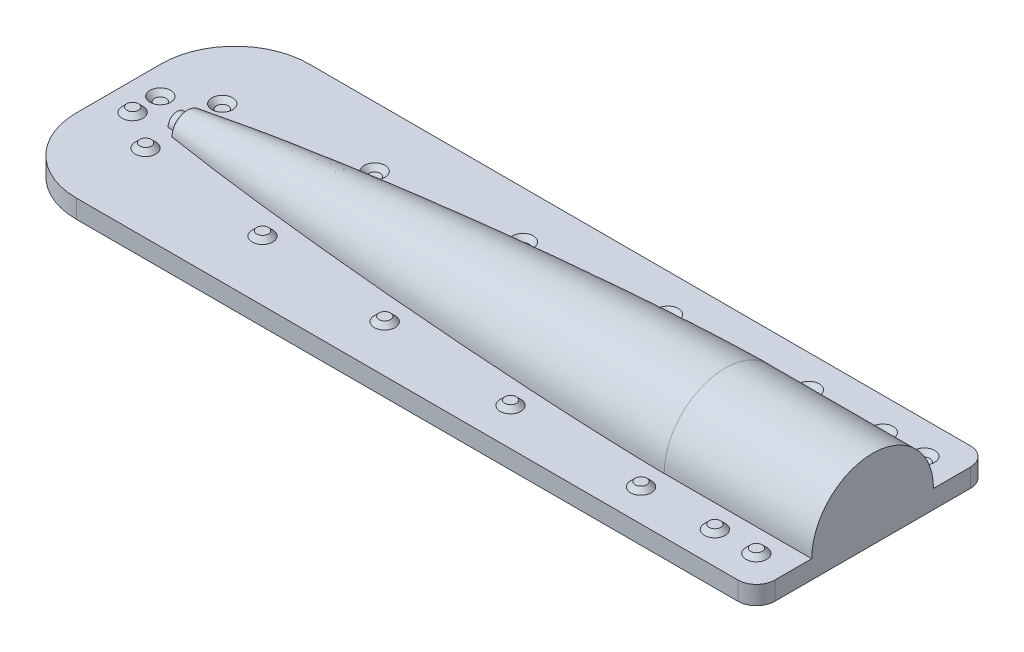
from build123d import *

# Parameters (mm, degrees)
MAIN_BODY_ANGLE               = 180
SKETCH2_W                     = 1128.421746079
SKETCH2_H                     = 320.04
BOSS_EXTRUDE1_DEPTH           = 25.4
FILLET1_R                     = 6.35
SKETCH3_R                     = 14.2875
BOSS_EXTRUDE2_DEPTH           = 6.35
BOSS_EXTRUDE2_DRAFT           = 45
BOSS_EXTRUDE2_PROFILE_2_DEPTH = 6.35
BOSS_EXTRUDE2_PROFILE_2_DRAFT = 45
BOSS_EXTRUDE2_PROFILE_3_DEPTH = 6.35
BOSS_EXTRUDE2_PROFILE_3_DRAFT = 45
BOSS_EXTRUDE2_PROFILE_4_DEPTH = 6.35
BOSS_EXTRUDE2_PROFILE_4_DRAFT = 45
BOSS_EXTRUDE2_PROFILE_5_DEPTH = 6.35
BOSS_EXTRUDE2_PROFILE_5_DRAFT = 45
BOSS_EXTRUDE2_PROFILE_6_DEPTH = 6.35
BOSS_EXTRUDE2_PROFILE_6_DRAFT = 45
BOSS_EXTRUDE2_PROFILE_7_DEPTH = 6.35
BOSS_EXTRUDE2_PROFILE_7_DRAFT = 45
BOSS_EXTRUDE2_PROFILE_8_DEPTH = 6.35
BOSS_EXTRUDE2_PROFILE_8_DRAFT = 45
BOSS_EXTRUDE2_PROFILE_9_DEPTH = 6.35
BOSS_EXTRUDE2_PROFILE_9_DRAFT = 45
SKETCH4_R                     = 14.2875
CUT_EXTRUDE1_DEPTH            = 6.35
CUT_EXTRUDE1_DRAFT            = -45
CUT_EXTRUDE1_PROFILE_2_DEPTH  = 6.35
CUT_EXTRUDE1_PROFILE_2_DRAFT  = -45
CUT_EXTRUDE1_PROFILE_3_DEPTH  = 6.35
CUT_EXTRUDE1_PROFILE_3_DRAFT  = -45
CUT_EXTRUDE1_PROFILE_4_DEPTH  = 6.35
CUT_EXTRUDE1_PROFILE_4_DRAFT  = -45
CUT_EXTRUDE1_PROFILE_5_DEPTH  = 6.35
CUT_EXTRUDE1_PROFILE_5_DRAFT  = -45
CUT_EXTRUDE1_PROFILE_6_DEPTH  = 6.35
CUT_EXTRUDE1_PROFILE_6_DRAFT  = -45
CUT_EXTRUDE1_PROFILE_7_DEPTH  = 6.35
CUT_EXTRUDE1_PROFILE_7_DRAFT  = -45
CUT_EXTRUDE1_PROFILE_8_DEPTH  = 6.35
CUT_EXTRUDE1_PROFILE_8_DRAFT  = -45
CUT_EXTRUDE1_PROFILE_9_DEPTH  = 6.35
CUT_EXTRUDE1_PROFILE_9_DRAFT  = -45
SKETCH5_W                     = 463.80049478
SKETCH5_H                     = 192.61122876
CUT_EXTRUDE2_DEPTH            = 90.587892
FILLET2_R                     = 25.4
FILLET3_R                     = 101.6


with BuildPart() as part:
    # Sketch1 → main body (revolve)
    with BuildSketch(Plane(origin=(0, 0, 0), x_dir=(1, 0, 0), z_dir=(0, 1, 0))):
        with BuildLine():
            Line((838.2, 83.82), (1041.4, 83.82))
            Line((1041.4, 83.82), (1055.402008508, 4.410663713))
            ThreePointArc((1055.402008508, 4.410663713), (1055.691236913, 2.213755866), (1055.787891581, 0))
            Line((1055.787891581, 0), (79.766145502, 0))
            ThreePointArc((79.766145502, 0), (80.010172441, 2.47764709), (80.732875439, 4.860079591))
            Line((80.732875439, 4.860079591), (83.9802768, 12.7))
            Line((83.9802768, 12.7), (96.6802768, 12.7))
            Line((96.6802768, 12.7), (98.225852671, 21.465396338))
            add(Edge.make_bspline(
                [(98.225852671, 21.465396338), (104.654328606, 22.492721153), (123.887764391, 25.486366873), (155.972005609, 30.143094939), (200.955569884, 36.09512031), (252.401811828, 42.306208001), (303.904445896, 48.029958479), (355.452205043, 53.329785664), (407.038239325, 58.242919226), (458.657507181, 62.792777027), (510.306645018, 66.990091608), (561.983121891, 70.836146847), (613.685225833, 74.321423415), (665.41176163, 77.424229696), (710.69328025, 79.769183333), (749.520737416, 81.469924508), (780.831685961, 82.59702331), (801.909844263, 83.213680173), (819.226063658, 83.60070134), (830.067937057, 83.761787884), (835.489248896, 83.813215153), (838.2, 83.82)],
                knots=[0.119456002, 0.119456002, 0.119456002, 0.119456002, 0.119456002, 0.150314205, 0.211721038, 0.273127872, 0.334534706, 0.395941541, 0.457348376, 0.518755211, 0.580162046, 0.641568881, 0.702975716, 0.764382551, 0.825789386, 0.887196222, 0.917899639, 0.948603057, 0.974301528, 0.987150764, 1, 1, 1, 1, 1], degree=4))
        make_face()
    revolve(axis=Axis((1055.787891581, 0, 0), (1, 0, 0)), revolution_arc=MAIN_BODY_ANGLE)

    # Sketch2 → Boss-Extrude1 (add)
    with BuildSketch(Plane.XZ):
        with Locations((567.777018541, 0)):
            Rectangle(SKETCH2_W, SKETCH2_H)
    extrude(amount=BOSS_EXTRUDE1_DEPTH)

    # Fillet1
    fillet1_edges = [part.edges().sort_by_distance(p)[0] for p in [
        (96.6802768, 12.7, 0),
    ]]
    fillet(fillet1_edges, radius=FILLET1_R)


with BuildPart() as boss_extrude2_tool:
    # Sketch3 → Boss-Extrude2 (with draft: the straight prism first)
    with BuildSketch(Plane(origin=(0, 0, 0), x_dir=(1, 0, 0), z_dir=(0, 1, 0))):
        with Locations((996.95, -115.57)):
            Circle(SKETCH3_R)
    extrude(amount=BOSS_EXTRUDE2_DEPTH)
    # Boss-Extrude2: the draft: its side faces are tilted about the plane it starts from
    boss_extrude2_sides = [boss_extrude2_tool.faces().sort_by_distance(p)[0] for p in [
        (982.6625, 3.175, 115.57),
    ]]
    draft(boss_extrude2_sides, Plane(origin=(0, 0, 0), x_dir=(1, 0, 0), z_dir=(0, 1, 0)), BOSS_EXTRUDE2_DRAFT)


with BuildPart() as part_1:
    add(part.part)

    # Boss-Extrude2: add boss_extrude2_tool
    add(boss_extrude2_tool.part)


with BuildPart() as boss_extrude2_profile_2_tool:
    # Sketch3 → Boss-Extrude2 profile 2 (with draft: the straight prism first)
    with BuildSketch(Plane(origin=(0, 0, 0), x_dir=(1, 0, 0), z_dir=(0, 1, 0))):
        with Locations((838.120531907, -115.569900548)):
            Circle(SKETCH3_R)
    extrude(amount=BOSS_EXTRUDE2_PROFILE_2_DEPTH)
    # Boss-Extrude2 profile 2: the draft: its side faces are tilted about the plane it starts from
    boss_extrude2_profile_2_sides = [boss_extrude2_profile_2_tool.faces().sort_by_distance(p)[0] for p in [
        (823.833031907, 3.175, 115.569900548),
    ]]
    draft(boss_extrude2_profile_2_sides, Plane(origin=(0, 0, 0), x_dir=(1, 0, 0), z_dir=(0, 1, 0)), BOSS_EXTRUDE2_PROFILE_2_DRAFT)


with BuildPart() as part_2:
    add(part_1.part)

    # Boss-Extrude2 profile 2: add boss_extrude2_profile_2_tool
    add(boss_extrude2_profile_2_tool.part)


with BuildPart() as boss_extrude2_profile_3_tool:
    # Sketch3 → Boss-Extrude2 profile 3 (with draft: the straight prism first)
    with BuildSketch(Plane(origin=(0, 0, 0), x_dir=(1, 0, 0), z_dir=(0, 1, 0))):
        with Locations((93.215509762, -52.81757272)):
            Circle(SKETCH3_R)
    extrude(amount=BOSS_EXTRUDE2_PROFILE_3_DEPTH)
    # Boss-Extrude2 profile 3: the draft: its side faces are tilted about the plane it starts from
    boss_extrude2_profile_3_sides = [boss_extrude2_profile_3_tool.faces().sort_by_distance(p)[0] for p in [
        (78.928009762, 3.175, 52.81757272),
    ]]
    draft(boss_extrude2_profile_3_sides, Plane(origin=(0, 0, 0), x_dir=(1, 0, 0), z_dir=(0, 1, 0)), BOSS_EXTRUDE2_PROFILE_3_DRAFT)


with BuildPart() as part_3:
    add(part_2.part)

    # Boss-Extrude2 profile 3: add boss_extrude2_profile_3_tool
    add(boss_extrude2_profile_3_tool.part)


with BuildPart() as boss_extrude2_profile_4_tool:
    # Sketch3 → Boss-Extrude2 profile 4 (with draft: the straight prism first)
    with BuildSketch(Plane(origin=(0, 0, 0), x_dir=(1, 0, 0), z_dir=(0, 1, 0))):
        with Locations((464.746746914, -95.093191467)):
            Circle(SKETCH3_R)
    extrude(amount=BOSS_EXTRUDE2_PROFILE_4_DEPTH)
    # Boss-Extrude2 profile 4: the draft: its side faces are tilted about the plane it starts from
    boss_extrude2_profile_4_sides = [boss_extrude2_profile_4_tool.faces().sort_by_distance(p)[0] for p in [
        (450.459246914, 3.175, 95.093191467),
    ]]
    draft(boss_extrude2_profile_4_sides, Plane(origin=(0, 0, 0), x_dir=(1, 0, 0), z_dir=(0, 1, 0)), BOSS_EXTRUDE2_PROFILE_4_DRAFT)


with BuildPart() as part_4:
    add(part_3.part)

    # Boss-Extrude2 profile 4: add boss_extrude2_profile_4_tool
    add(boss_extrude2_profile_4_tool.part)


with BuildPart() as boss_extrude2_profile_5_tool:
    # Sketch3 → Boss-Extrude2 profile 5 (with draft: the straight prism first)
    with BuildSketch(Plane(origin=(0, 0, 0), x_dir=(1, 0, 0), z_dir=(0, 1, 0))):
        with Locations((278.620294473, -77.126501911)):
            Circle(SKETCH3_R)
    extrude(amount=BOSS_EXTRUDE2_PROFILE_5_DEPTH)
    # Boss-Extrude2 profile 5: the draft: its side faces are tilted about the plane it starts from
    boss_extrude2_profile_5_sides = [boss_extrude2_profile_5_tool.faces().sort_by_distance(p)[0] for p in [
        (264.332794473, 3.175, 77.126501911),
    ]]
    draft(boss_extrude2_profile_5_sides, Plane(origin=(0, 0, 0), x_dir=(1, 0, 0), z_dir=(0, 1, 0)), BOSS_EXTRUDE2_PROFILE_5_DRAFT)


with BuildPart() as part_5:
    add(part_4.part)

    # Boss-Extrude2 profile 5: add boss_extrude2_profile_5_tool
    add(boss_extrude2_profile_5_tool.part)


with BuildPart() as boss_extrude2_profile_6_tool:
    # Sketch3 → Boss-Extrude2 profile 6 (with draft: the straight prism first)
    with BuildSketch(Plane(origin=(0, 0, 0), x_dir=(1, 0, 0), z_dir=(0, 1, 0))):
        with Locations((651.269008133, -108.333444552)):
            Circle(SKETCH3_R)
    extrude(amount=BOSS_EXTRUDE2_PROFILE_6_DEPTH)
    # Boss-Extrude2 profile 6: the draft: its side faces are tilted about the plane it starts from
    boss_extrude2_profile_6_sides = [boss_extrude2_profile_6_tool.faces().sort_by_distance(p)[0] for p in [
        (636.981508133, 3.175, 108.333444552),
    ]]
    draft(boss_extrude2_profile_6_sides, Plane(origin=(0, 0, 0), x_dir=(1, 0, 0), z_dir=(0, 1, 0)), BOSS_EXTRUDE2_PROFILE_6_DRAFT)


with BuildPart() as part_6:
    add(part_5.part)

    # Boss-Extrude2 profile 6: add boss_extrude2_profile_6_tool
    add(boss_extrude2_profile_6_tool.part)


with BuildPart() as boss_extrude2_profile_7_tool:
    # Sketch3 → Boss-Extrude2 profile 7 (with draft: the straight prism first)
    with BuildSketch(Plane(origin=(0, 0, 0), x_dir=(1, 0, 0), z_dir=(0, 1, 0))):
        with Locations((41.666145502, -19.05)):
            Circle(SKETCH3_R)
    extrude(amount=BOSS_EXTRUDE2_PROFILE_7_DEPTH)
    # Boss-Extrude2 profile 7: the draft: its side faces are tilted about the plane it starts from
    boss_extrude2_profile_7_sides = [boss_extrude2_profile_7_tool.faces().sort_by_distance(p)[0] for p in [
        (27.378645502, 3.175, 19.05),
    ]]
    draft(boss_extrude2_profile_7_sides, Plane(origin=(0, 0, 0), x_dir=(1, 0, 0), z_dir=(0, 1, 0)), BOSS_EXTRUDE2_PROFILE_7_DRAFT)


with BuildPart() as part_7:
    add(part_6.part)

    # Boss-Extrude2 profile 7: add boss_extrude2_profile_7_tool
    add(boss_extrude2_profile_7_tool.part)


with BuildPart() as boss_extrude2_profile_8_tool:
    # Sketch3 → Boss-Extrude2 profile 8 (with draft: the straight prism first)
    with BuildSketch(Plane(origin=(0, 0, 0), x_dir=(1, 0, 0), z_dir=(0, 1, 0))):
        with Locations((1079.668650412, -49.628661497)):
            Circle(SKETCH3_R)
    extrude(amount=BOSS_EXTRUDE2_PROFILE_8_DEPTH)
    # Boss-Extrude2 profile 8: the draft: its side faces are tilted about the plane it starts from
    boss_extrude2_profile_8_sides = [boss_extrude2_profile_8_tool.faces().sort_by_distance(p)[0] for p in [
        (1065.381150412, 3.175, 49.628661497),
    ]]
    draft(boss_extrude2_profile_8_sides, Plane(origin=(0, 0, 0), x_dir=(1, 0, 0), z_dir=(0, 1, 0)), BOSS_EXTRUDE2_PROFILE_8_DRAFT)


with BuildPart() as part_8:
    add(part_7.part)

    # Boss-Extrude2 profile 8: add boss_extrude2_profile_8_tool
    add(boss_extrude2_profile_8_tool.part)


with BuildPart() as boss_extrude2_profile_9_tool:
    # Sketch3 → Boss-Extrude2 profile 9 (with draft: the straight prism first)
    with BuildSketch(Plane(origin=(0, 0, 0), x_dir=(1, 0, 0), z_dir=(0, 1, 0))):
        with Locations((939.8, -115.57)):
            Circle(SKETCH3_R)
    extrude(amount=BOSS_EXTRUDE2_PROFILE_9_DEPTH)
    # Boss-Extrude2 profile 9: the draft: its side faces are tilted about the plane it starts from
    boss_extrude2_profile_9_sides = [boss_extrude2_profile_9_tool.faces().sort_by_distance(p)[0] for p in [
        (925.5125, 3.175, 115.57),
    ]]
    draft(boss_extrude2_profile_9_sides, Plane(origin=(0, 0, 0), x_dir=(1, 0, 0), z_dir=(0, 1, 0)), BOSS_EXTRUDE2_PROFILE_9_DRAFT)


with BuildPart() as part_9:
    add(part_8.part)

    # Boss-Extrude2 profile 9: add boss_extrude2_profile_9_tool
    add(boss_extrude2_profile_9_tool.part)


with BuildPart() as cut_extrude1_tool:
    # Sketch4 → Cut-Extrude1 (with draft: the straight prism first)
    with BuildSketch(Plane(origin=(0, 0, 0), x_dir=(1, 0, 0), z_dir=(0, 1, 0))):
        with Locations((996.95, 115.57)):
            Circle(SKETCH4_R)
    extrude(amount=-CUT_EXTRUDE1_DEPTH)
    # Cut-Extrude1: the draft: its side faces are tilted about the plane it starts from
    cut_extrude1_sides = [cut_extrude1_tool.faces().sort_by_distance(p)[0] for p in [
        (982.6625, -3.175, -115.57),
    ]]
    draft(cut_extrude1_sides, Plane(origin=(0, 0, 0), x_dir=(1, 0, 0), z_dir=(0, 1, 0)), CUT_EXTRUDE1_DRAFT)


with BuildPart() as part_10:
    add(part_9.part)

    # Cut-Extrude1: cut by cut_extrude1_tool
    add(cut_extrude1_tool.part, mode=Mode.SUBTRACT)


with BuildPart() as cut_extrude1_profile_2_tool:
    # Sketch4 → Cut-Extrude1 profile 2 (with draft: the straight prism first)
    with BuildSketch(Plane(origin=(0, 0, 0), x_dir=(1, 0, 0), z_dir=(0, 1, 0))):
        with Locations((838.120531907, 115.569900548)):
            Circle(SKETCH4_R)
    extrude(amount=-CUT_EXTRUDE1_PROFILE_2_DEPTH)
    # Cut-Extrude1 profile 2: the draft: its side faces are tilted about the plane it starts from
    cut_extrude1_profile_2_sides = [cut_extrude1_profile_2_tool.faces().sort_by_distance(p)[0] for p in [
        (823.833031907, -3.175, -115.569900548),
    ]]
    draft(cut_extrude1_profile_2_sides, Plane(origin=(0, 0, 0), x_dir=(1, 0, 0), z_dir=(0, 1, 0)), CUT_EXTRUDE1_PROFILE_2_DRAFT)


with BuildPart() as part_11:
    add(part_10.part)

    # Cut-Extrude1 profile 2: cut by cut_extrude1_profile_2_tool
    add(cut_extrude1_profile_2_tool.part, mode=Mode.SUBTRACT)


with BuildPart() as cut_extrude1_profile_3_tool:
    # Sketch4 → Cut-Extrude1 profile 3 (with draft: the straight prism first)
    with BuildSketch(Plane(origin=(0, 0, 0), x_dir=(1, 0, 0), z_dir=(0, 1, 0))):
        with Locations((93.215509762, 52.81757272)):
            Circle(SKETCH4_R)
    extrude(amount=-CUT_EXTRUDE1_PROFILE_3_DEPTH)
    # Cut-Extrude1 profile 3: the draft: its side faces are tilted about the plane it starts from
    cut_extrude1_profile_3_sides = [cut_extrude1_profile_3_tool.faces().sort_by_distance(p)[0] for p in [
        (78.928009762, -3.175, -52.81757272),
    ]]
    draft(cut_extrude1_profile_3_sides, Plane(origin=(0, 0, 0), x_dir=(1, 0, 0), z_dir=(0, 1, 0)), CUT_EXTRUDE1_PROFILE_3_DRAFT)


with BuildPart() as part_12:
    add(part_11.part)

    # Cut-Extrude1 profile 3: cut by cut_extrude1_profile_3_tool
    add(cut_extrude1_profile_3_tool.part, mode=Mode.SUBTRACT)


with BuildPart() as cut_extrude1_profile_4_tool:
    # Sketch4 → Cut-Extrude1 profile 4 (with draft: the straight prism first)
    with BuildSketch(Plane(origin=(0, 0, 0), x_dir=(1, 0, 0), z_dir=(0, 1, 0))):
        with Locations((464.746746914, 95.093191467)):
            Circle(SKETCH4_R)
    extrude(amount=-CUT_EXTRUDE1_PROFILE_4_DEPTH)
    # Cut-Extrude1 profile 4: the draft: its side faces are tilted about the plane it starts from
    cut_extrude1_profile_4_sides = [cut_extrude1_profile_4_tool.faces().sort_by_distance(p)[0] for p in [
        (450.459246914, -3.175, -95.093191467),
    ]]
    draft(cut_extrude1_profile_4_sides, Plane(origin=(0, 0, 0), x_dir=(1, 0, 0), z_dir=(0, 1, 0)), CUT_EXTRUDE1_PROFILE_4_DRAFT)


with BuildPart() as part_13:
    add(part_12.part)

    # Cut-Extrude1 profile 4: cut by cut_extrude1_profile_4_tool
    add(cut_extrude1_profile_4_tool.part, mode=Mode.SUBTRACT)


with BuildPart() as cut_extrude1_profile_5_tool:
    # Sketch4 → Cut-Extrude1 profile 5 (with draft: the straight prism first)
    with BuildSketch(Plane(origin=(0, 0, 0), x_dir=(1, 0, 0), z_dir=(0, 1, 0))):
        with Locations((278.620294473, 77.126501911)):
            Circle(SKETCH4_R)
    extrude(amount=-CUT_EXTRUDE1_PROFILE_5_DEPTH)
    # Cut-Extrude1 profile 5: the draft: its side faces are tilted about the plane it starts from
    cut_extrude1_profile_5_sides = [cut_extrude1_profile_5_tool.faces().sort_by_distance(p)[0] for p in [
        (264.332794473, -3.175, -77.126501911),
    ]]
    draft(cut_extrude1_profile_5_sides, Plane(origin=(0, 0, 0), x_dir=(1, 0, 0), z_dir=(0, 1, 0)), CUT_EXTRUDE1_PROFILE_5_DRAFT)


with BuildPart() as part_14:
    add(part_13.part)

    # Cut-Extrude1 profile 5: cut by cut_extrude1_profile_5_tool
    add(cut_extrude1_profile_5_tool.part, mode=Mode.SUBTRACT)


with BuildPart() as cut_extrude1_profile_6_tool:
    # Sketch4 → Cut-Extrude1 profile 6 (with draft: the straight prism first)
    with BuildSketch(Plane(origin=(0, 0, 0), x_dir=(1, 0, 0), z_dir=(0, 1, 0))):
        with Locations((651.269008133, 108.333444552)):
            Circle(SKETCH4_R)
    extrude(amount=-CUT_EXTRUDE1_PROFILE_6_DEPTH)
    # Cut-Extrude1 profile 6: the draft: its side faces are tilted about the plane it starts from
    cut_extrude1_profile_6_sides = [cut_extrude1_profile_6_tool.faces().sort_by_distance(p)[0] for p in [
        (636.981508133, -3.175, -108.333444552),
    ]]
    draft(cut_extrude1_profile_6_sides, Plane(origin=(0, 0, 0), x_dir=(1, 0, 0), z_dir=(0, 1, 0)), CUT_EXTRUDE1_PROFILE_6_DRAFT)


with BuildPart() as part_15:
    add(part_14.part)

    # Cut-Extrude1 profile 6: cut by cut_extrude1_profile_6_tool
    add(cut_extrude1_profile_6_tool.part, mode=Mode.SUBTRACT)


with BuildPart() as cut_extrude1_profile_7_tool:
    # Sketch4 → Cut-Extrude1 profile 7 (with draft: the straight prism first)
    with BuildSketch(Plane(origin=(0, 0, 0), x_dir=(1, 0, 0), z_dir=(0, 1, 0))):
        with Locations((41.666145502, 19.05)):
            Circle(SKETCH4_R)
    extrude(amount=-CUT_EXTRUDE1_PROFILE_7_DEPTH)
    # Cut-Extrude1 profile 7: the draft: its side faces are tilted about the plane it starts from
    cut_extrude1_profile_7_sides = [cut_extrude1_profile_7_tool.faces().sort_by_distance(p)[0] for p in [
        (27.378645502, -3.175, -19.05),
    ]]
    draft(cut_extrude1_profile_7_sides, Plane(origin=(0, 0, 0), x_dir=(1, 0, 0), z_dir=(0, 1, 0)), CUT_EXTRUDE1_PROFILE_7_DRAFT)


with BuildPart() as part_16:
    add(part_15.part)

    # Cut-Extrude1 profile 7: cut by cut_extrude1_profile_7_tool
    add(cut_extrude1_profile_7_tool.part, mode=Mode.SUBTRACT)


with BuildPart() as cut_extrude1_profile_8_tool:
    # Sketch4 → Cut-Extrude1 profile 8 (with draft: the straight prism first)
    with BuildSketch(Plane(origin=(0, 0, 0), x_dir=(1, 0, 0), z_dir=(0, 1, 0))):
        with Locations((1079.668650412, 49.628661497)):
            Circle(SKETCH4_R)
    extrude(amount=-CUT_EXTRUDE1_PROFILE_8_DEPTH)
    # Cut-Extrude1 profile 8: the draft: its side faces are tilted about the plane it starts from
    cut_extrude1_profile_8_sides = [cut_extrude1_profile_8_tool.faces().sort_by_distance(p)[0] for p in [
        (1065.381150412, -3.175, -49.628661497),
    ]]
    draft(cut_extrude1_profile_8_sides, Plane(origin=(0, 0, 0), x_dir=(1, 0, 0), z_dir=(0, 1, 0)), CUT_EXTRUDE1_PROFILE_8_DRAFT)


with BuildPart() as part_17:
    add(part_16.part)

    # Cut-Extrude1 profile 8: cut by cut_extrude1_profile_8_tool
    add(cut_extrude1_profile_8_tool.part, mode=Mode.SUBTRACT)


with BuildPart() as cut_extrude1_profile_9_tool:
    # Sketch4 → Cut-Extrude1 profile 9 (with draft: the straight prism first)
    with BuildSketch(Plane(origin=(0, 0, 0), x_dir=(1, 0, 0), z_dir=(0, 1, 0))):
        with Locations((939.8, 115.57)):
            Circle(SKETCH4_R)
    extrude(amount=-CUT_EXTRUDE1_PROFILE_9_DEPTH)
    # Cut-Extrude1 profile 9: the draft: its side faces are tilted about the plane it starts from
    cut_extrude1_profile_9_sides = [cut_extrude1_profile_9_tool.faces().sort_by_distance(p)[0] for p in [
        (925.5125, -3.175, -115.57),
    ]]
    draft(cut_extrude1_profile_9_sides, Plane(origin=(0, 0, 0), x_dir=(1, 0, 0), z_dir=(0, 1, 0)), CUT_EXTRUDE1_PROFILE_9_DRAFT)


with BuildPart() as part_18:
    add(part_17.part)

    # Cut-Extrude1 profile 9: cut by cut_extrude1_profile_9_tool
    add(cut_extrude1_profile_9_tool.part, mode=Mode.SUBTRACT)

    # Sketch5 → Cut-Extrude2 (cut)
    with BuildSketch(Plane(origin=(1131.987891581, 0, 0), x_dir=(0, 0, -1), z_dir=(1, 0, 0))):
        with Locations((-3.860998016, 22.292900365)):
            Rectangle(SKETCH5_W, SKETCH5_H)
    extrude(amount=-CUT_EXTRUDE2_DEPTH, mode=Mode.SUBTRACT)

    # Fillet2
    fillet2_edges = [part_18.edges().sort_by_distance(p)[0] for p in [
        (1041.399999581, -12.7, -160.02),
        (1041.399999581, -12.7, 160.02),
    ]]
    fillet(fillet2_edges, radius=FILLET2_R)

    # Fillet3
    fillet3_edges = [part_18.edges().sort_by_distance(p)[0] for p in [
        (3.566145502, -12.7, 160.02),
        (3.566145502, -12.7, -160.02),
    ]]
    fillet(fillet3_edges, radius=FILLET3_R)


solid = part_18.part
